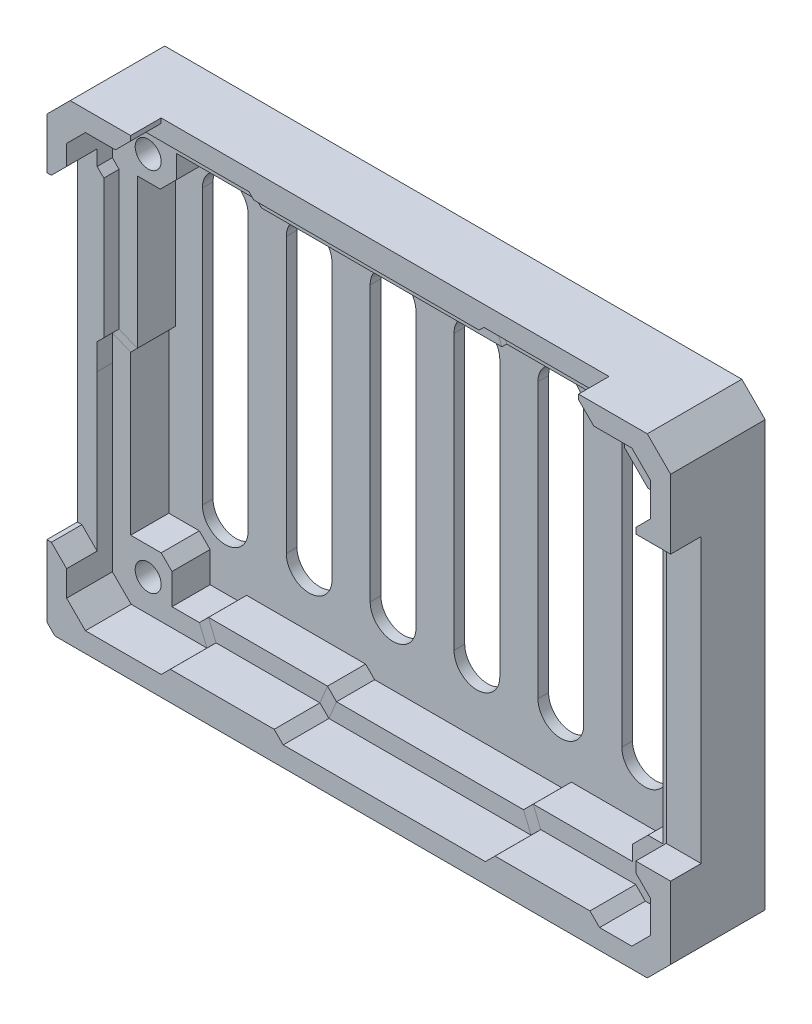
from build123d import *

# Parameters (mm, degrees)
SKETCH_1_W           = 75
SKETCH_1_H           = 55
EXTRUDE_1_DEPTH      = 12
SKETCH_2_R           = 1.7
CUT_EXTRUDE_1_DEPTH  = 12
SKETCH_5_W           = 85
SKETCH_5_H           = 65
SKETCH_5_W_2         = 75
SKETCH_5_H_2         = 55
EXTRUDE_2_DEPTH      = 12
CUT_EXTRUDE_3_DEPTH  = 2
SKETCH_8_W           = 0.8
SKETCH_8_H           = 2
CUT_EXTRUDE_4_DEPTH  = 4
SKETCH_12_W          = 1.6
SKETCH_12_H          = 4
EXTRUDE_3_DEPTH      = 4
SKETCH_16_R          = 1.7
CUT_EXTRUDE_6_DEPTH  = 4
CUT_EXTRUDE_7_DEPTH  = 6
CHAMFER_1_SIZE       = 4
CHAMFER_2_SIZE       = 2
EXTRUDE_4_DEPTH      = 4
CHAMFER_4_SIZE       = 2
CUT_EXTRUDE_12_DEPTH = 3.6
CUT_EXTRUDE_15_DEPTH = 1
CUT_EXTRUDE_16_DEPTH = 101.765867237
SKETCH_28_R          = 3.1
CUT_EXTRUDE_17_DEPTH = 4


with BuildPart() as part:
    # 草图1 → 凸台-拉伸1 (new body)
    with BuildSketch(Plane.XY):
        with Locations((37.5, -27.5)):
            Rectangle(SKETCH_1_W, SKETCH_1_H)
    extrude(amount=EXTRUDE_1_DEPTH)

    # 草图2 → 切除-拉伸1 (cut)
    with BuildSketch(Plane(origin=(0, 0, 0), x_dir=(-1, 0, 0), z_dir=(0, 0, -1))):
        with Locations((-71.166921514, -3.557475235)):
            Circle(SKETCH_2_R)
        with Locations((-71.166921514, -51.58491491)):
            Circle(SKETCH_2_R)
        with Locations((-3.888803658, -51.58491491)):
            Circle(SKETCH_2_R)
        with Locations((-3.888803658, -3.557475235)):
            Circle(SKETCH_2_R)
    extrude(amount=-CUT_EXTRUDE_1_DEPTH, mode=Mode.SUBTRACT)

    # 草图5 → 凸台-拉伸2 (add)
    with BuildSketch(Plane(origin=(0, 0, 0), x_dir=(-1, 0, 0), z_dir=(0, 0, -1))):
        with Locations((-37.5, -27.5)):
            Rectangle(SKETCH_5_W, SKETCH_5_H)
        with Locations((-37.5, -27.5)):
            Rectangle(SKETCH_5_W_2, SKETCH_5_H_2, mode=Mode.SUBTRACT)
    extrude(amount=-EXTRUDE_2_DEPTH)

    # 草图6 → 切除-拉伸3 (cut)
    with BuildSketch(Plane.XY.offset(12)):
        Polygon((0.871324699, -25.665782408), (0, -26.537107106), (0, -53.007434423), (1.992565577, -55), (11.269684867, -55), (12.461559563, -53.813385827), (26.743585303, -53.817105578), (27.926479725, -55), (53.772720173, -55), (55.043505207, -53.734475489), (68.152434681, -53.73819524), (69.414239441, -55), (72.982184232, -55), (74.974749809, -53.007434423), (74.974749809, -49.491704516), (73.028310897, -47.54000508), (73.032030648, -7.646889678), (74.974749809, -5.704170516), (74.974749809, -2.017856408), (72.982184232, -0.025290831), (50.245113202, -0.025290831), (49.61482093, -0.650322581), (19.394872914, -0.646602829), (18.773560915, -0.025290831), (1.992565577, -0.025290831), (0, -2.017856408), (0, -5.982633813), (0.87504445, -6.862938786), align=None)
    extrude(amount=-CUT_EXTRUDE_3_DEPTH, mode=Mode.SUBTRACT)

    # Sweep 1: sweep along a path in 草图7
    with BuildLine(Plane.XY.offset(10)) as sweep_1_path:
        Line((0.87504445, -6.862938786), (0.871324699, -25.665782408))
        Line((0.871324699, -25.665782408), (0, -26.537107106))
        Line((0, -26.537107106), (0, -53.007434423))
        Line((0, -53.007434423), (1.992565577, -55))
        Line((1.992565577, -55), (11.269684867, -55))
        Line((11.269684867, -55), (12.461559563, -53.813385827))
        Line((12.461559563, -53.813385827), (26.743585303, -53.817105578))
        Line((26.743585303, -53.817105578), (27.926479725, -55))
        Line((27.926479725, -55), (53.772720173, -55))
        Line((53.772720173, -55), (55.043505207, -53.734475489))
        Line((55.043505207, -53.734475489), (68.152434681, -53.73819524))
        Line((68.152434681, -53.73819524), (69.414239441, -55))
        Line((69.414239441, -55), (72.982184232, -55))
        Line((72.982184232, -55), (74.974749809, -53.007434423))
        Line((74.974749809, -53.007434423), (74.974749809, -49.491704516))
        Line((74.974749809, -49.491704516), (73.028310897, -47.54000508))
        Line((73.028310897, -47.54000508), (73.032030648, -7.646889678))
        Line((73.032030648, -7.646889678), (74.974749809, -5.704170516))
        Line((74.974749809, -5.704170516), (74.974749809, -2.017856408))
        Line((74.974749809, -2.017856408), (72.982184232, -0.025290831))
        Line((72.982184232, -0.025290831), (50.245113202, -0.025290831))
        Line((50.245113202, -0.025290831), (49.61482093, -0.650322581))
        Line((49.61482093, -0.650322581), (19.394872914, -0.646602829))
        Line((19.394872914, -0.646602829), (18.773560915, -0.025290831))
        Line((18.773560915, -0.025290831), (1.992565577, -0.025290831))
        Line((1.992565577, -0.025290831), (0, -2.017856408))
        Line((0, -2.017856408), (0, -5.982633813))
        Line((0, -5.982633813), (0.87504445, -6.862938786))
    # 草图8 → Sweep 1 (sweep, cut)
    with BuildSketch(Plane(origin=(47.466326748, -29.617285171, 16.834886136), x_dir=(1, 0, 0), z_dir=(0, 1, 0))):
        with Locations((-47.866326748, 5.834886136)):
            Rectangle(SKETCH_8_W, SKETCH_8_H)
    sweep(path=sweep_1_path.line, transition=Transition.RIGHT, mode=Mode.SUBTRACT)

    # 草图9 → 切除-拉伸4 (cut)
    with BuildSketch(Plane.XY.offset(10)):
        Polygon((0.871324699, -25.665782408), (0, -26.537107106), (0, -53.007434423), (1.992565577, -55), (11.269684867, -55), (12.461559563, -53.813385827), (26.743585303, -53.817105578), (27.926479725, -55), (53.772720173, -55), (55.043505207, -53.734475489), (68.152434681, -53.73819524), (69.414239441, -55), (72.982184232, -55), (74.974749809, -53.007434423), (74.974749809, -49.491704516), (73.028310897, -47.54000508), (73.032030648, -7.646889678), (74.974749809, -5.704170516), (74.974749809, -2.017856408), (72.982184232, -0.025290831), (50.245113202, -0.025290831), (49.61482093, -0.650322581), (19.394872914, -0.646602829), (18.773560915, -0.025290831), (1.992565577, -0.025290831), (0, -2.017856408), (0, -5.982633813), (0.87504445, -6.862938786), align=None)
    extrude(amount=-CUT_EXTRUDE_4_DEPTH, mode=Mode.SUBTRACT)

    # Sweep 1 2: sweep along a path in 草图10
    with BuildLine(Plane.XY.offset(6)) as sweep_1_2_path:
        Line((0.87504445, -6.862938786), (0.871324699, -25.665782408))
        Line((0.871324699, -25.665782408), (0, -26.537107106))
        Line((0, -26.537107106), (0, -53.007434423))
        Line((0, -53.007434423), (1.992565577, -55))
        Line((1.992565577, -55), (11.269684867, -55))
        Line((11.269684867, -55), (12.461559563, -53.813385827))
        Line((12.461559563, -53.813385827), (26.743585303, -53.817105578))
        Line((26.743585303, -53.817105578), (27.926479725, -55))
        Line((27.926479725, -55), (53.772720173, -55))
        Line((53.772720173, -55), (55.043505207, -53.734475489))
        Line((55.043505207, -53.734475489), (68.152434681, -53.73819524))
        Line((68.152434681, -53.73819524), (69.414239441, -55))
        Line((69.414239441, -55), (72.982184232, -55))
        Line((72.982184232, -55), (74.974749809, -53.007434423))
        Line((74.974749809, -53.007434423), (74.974749809, -49.491704516))
        Line((74.974749809, -49.491704516), (73.028310897, -47.54000508))
        Line((73.028310897, -47.54000508), (73.032030648, -7.646889678))
        Line((73.032030648, -7.646889678), (74.974749809, -5.704170516))
        Line((74.974749809, -5.704170516), (74.974749809, -2.017856408))
        Line((74.974749809, -2.017856408), (72.982184232, -0.025290831))
        Line((72.982184232, -0.025290831), (50.245113202, -0.025290831))
        Line((50.245113202, -0.025290831), (49.61482093, -0.650322581))
        Line((49.61482093, -0.650322581), (19.394872914, -0.646602829))
        Line((19.394872914, -0.646602829), (18.773560915, -0.025290831))
        Line((18.773560915, -0.025290831), (1.992565577, -0.025290831))
        Line((1.992565577, -0.025290831), (0, -2.017856408))
        Line((0, -2.017856408), (0, -5.982633813))
        Line((0, -5.982633813), (0.87504445, -6.862938786))
    # 草图12 → Sweep 1 2 (sweep)
    with BuildSketch(Plane(origin=(47.466326748, -29.617285171, 16.834886136), x_dir=(1, 0, 0), z_dir=(0, 1, 0))):
        with Locations((24.763844024, 8.834886136)):
            Rectangle(SKETCH_12_W, SKETCH_12_H)
    sweep(path=sweep_1_2_path.line, transition=Transition.RIGHT)

    # 草图15 → 凸台-拉伸3 (add)
    with BuildSketch(Plane.XY.offset(6)):
        Polygon((1.599811284, -47.985975153), (5.599811284, -47.985975153), (7.014024847, -49.400188716), (7.014024847, -53.400188716), (2.655229109, -53.400188716), (1.599811284, -52.344770891), align=None)
        Polygon((71.42844383, -48.138178454), (69.42844383, -48.138178454), (67.42844383, -50.138178454), (67.42844383, -52.138178454), (68.815286237, -52.13857198), (70.076902972, -53.400188716), (72.319520701, -53.400188716), (73.374938525, -52.344770891), (73.374938525, -50.153103724), (71.42843794, -48.201342449), align=None)
        Polygon((7.59619916, -1.625102115), (7.59619916, -4.625102115), (5.474878816, -6.746422459), (2.474878816, -6.746422459), (2.474986279, -6.203213329), (1.599811284, -5.322777027), (1.599811284, -2.680519939), (2.655229109, -1.625102115), align=None)
        Polygon((72.319520701, -1.625102115), (66.319520701, -1.625102115), (66.319520701, -5.625102115), (69.432117646, -8.73769906), (71.432117646, -8.73769906), (71.432281151, -6.984164359), (73.303483781, -5.112961729), (73.374938525, -5.041506985), (73.374938525, -2.680519939), align=None)
    extrude(amount=EXTRUDE_3_DEPTH)

    # 草图16 → 切除-拉伸6 (cut)
    with BuildSketch(Plane(origin=(0, 0, 6), x_dir=(-1, 0, 0), z_dir=(0, 0, -1))):
        with Locations((-3.888803658, -51.58491491)):
            Circle(SKETCH_16_R)
        with Locations((-71.166921514, -51.58491491)):
            Circle(SKETCH_16_R)
        with Locations((-71.166921514, -3.557475235)):
            Circle(SKETCH_16_R)
        with Locations((-3.888803658, -3.557475235)):
            Circle(SKETCH_16_R)
    extrude(amount=-CUT_EXTRUDE_6_DEPTH, mode=Mode.SUBTRACT)

    # 草图17 → 切除-拉伸7 (cut)
    with BuildSketch(Plane.XY.offset(6)):
        with BuildLine():
            Line((12, -8.852281976), (12, -44.852281976))
            ThreePointArc((12, -44.852281976), (9, -47.852281976), (6, -44.852281976))
            Line((6, -44.852281976), (6, -8.852281976))
            ThreePointArc((6, -8.852281976), (9, -5.852281976), (12, -8.852281976))
        make_face()
        with BuildLine():
            Line((23, -8.852281976), (23, -44.852281976))
            ThreePointArc((23, -44.852281976), (20, -47.852281976), (17, -44.852281976))
            Line((17, -44.852281976), (17, -8.852281976))
            ThreePointArc((17, -8.852281976), (20, -5.852281976), (23, -8.852281976))
        make_face()
        with BuildLine():
            Line((34, -8.852281976), (34, -44.852281976))
            ThreePointArc((34, -44.852281976), (31, -47.852281976), (28, -44.852281976))
            Line((28, -44.852281976), (28, -8.852281976))
            ThreePointArc((28, -8.852281976), (31, -5.852281976), (34, -8.852281976))
        make_face()
        with BuildLine():
            Line((45, -8.852281976), (45, -44.852281976))
            ThreePointArc((45, -44.852281976), (42, -47.852281976), (39, -44.852281976))
            Line((39, -44.852281976), (39, -8.852281976))
            ThreePointArc((39, -8.852281976), (42, -5.852281976), (45, -8.852281976))
        make_face()
        with BuildLine():
            Line((56, -8.852281976), (56, -44.852281976))
            ThreePointArc((56, -44.852281976), (53, -47.852281976), (50, -44.852281976))
            Line((50, -44.852281976), (50, -8.852281976))
            ThreePointArc((50, -8.852281976), (53, -5.852281976), (56, -8.852281976))
        make_face()
        with BuildLine():
            Line((67, -8.852281976), (67, -44.852281976))
            ThreePointArc((67, -44.852281976), (64, -47.852281976), (61, -44.852281976))
            Line((61, -44.852281976), (61, -8.852281976))
            ThreePointArc((61, -8.852281976), (64, -5.852281976), (67, -8.852281976))
        make_face()
    extrude(amount=-CUT_EXTRUDE_7_DEPTH, mode=Mode.SUBTRACT)

    # 倒角1
    chamfer_1_edges = [part.edges().sort_by_distance(p)[0] for p in [
        (-5, 5, 6),
        (80, -60, 6),
        (80, 5, 6),
    ]]
    chamfer(chamfer_1_edges, length=CHAMFER_1_SIZE)

    # 倒角2
    chamfer_2_edges = [part.edges().sort_by_distance(p)[0] for p in [
        (-5, -60, 6),
    ]]
    chamfer(chamfer_2_edges, length=CHAMFER_2_SIZE)

    # 草图20 → 凸台-拉伸4 (add)
    with BuildSketch(Plane.XY.offset(12)):
        Polygon((-5, -6.312601125), (-0.8, -6.312601125), (-0.8, -1.686485558), (1.661194727, 0.774709169), (7.59619916, 0.774709169), (7.59619916, 5), (-1, 5), (-5, 1), align=None)
        Polygon((-0.8, -53.338805273), (-0.8, -47.985975153), (-5, -47.985975153), (-5, -58), (-3, -60), (76, -60), (80, -56), (80, -45.869766166), (73.828466638, -45.869766166), (73.828341736, -47.209297389), (75.774749809, -49.160965902), (75.774749809, -53.338805273), (73.313555082, -55.8), (69.580957304, -55.8), (69.082868591, -55.8), (67.820969808, -54.538101217), (55.37381035, -54.534569248), (54.103119465, -55.8), (27.595108875, -55.8), (26.412128153, -54.617019277), (12.791807996, -54.613471867), (11.600019722, -55.8), (1.661194727, -55.8), align=None)
        Polygon((76, 5), (66.319520701, 5), (66.319520701, 0.774709169), (73.313555082, 0.774709169), (75.774749809, -1.686485558), (75.774749809, -6.035541366), (73.831999751, -7.978291425), (73.831928941, -8.73769906), (80, -8.73769906), (80, 1), align=None)
    extrude(amount=EXTRUDE_4_DEPTH)

    # 倒角4
    chamfer_4_edges = [part.edges().sort_by_distance(p)[0] for p in [
        (7.59619916, 0.774709169, 14),
        (-0.8, -6.312601125, 14),
        (66.319520701, 0.774709169, 14),
        (-0.8, -47.985975153, 14),
    ]]
    chamfer(chamfer_4_edges, length=CHAMFER_4_SIZE)

    # 草图24 → 切除-拉伸12 (cut)
    with BuildSketch(Plane(origin=(0, 0, 0), x_dir=(-1, 0, 0), z_dir=(0, 0, -1))):
        Polygon((-76, -60), (3, -60), (5, -58), (5, 1), (1, 5), (-76, 5), (-80, 1), (-80, -56), align=None)
    extrude(amount=-CUT_EXTRUDE_12_DEPTH, mode=Mode.SUBTRACT)

    # 草图26 → 切除-拉伸15 (cut)
    with BuildSketch(Plane.XY.offset(6)):
        Polygon((67.42844383, -50.138178454), (69.42844383, -48.138178454), (71.42844383, -48.138178454), (71.430170772, -29.617285171), (71.432117646, -8.73769906), (69.432117646, -8.73769906), (66.319520701, -5.625102115), (66.319520701, -1.625102115), (50.903852973, -1.625102115), (50.273478932, -2.250214951), (18.732127818, -2.246332549), (18.110897384, -1.625102115), (7.59619916, -1.625102115), (7.59619916, -4.625102115), (5.474878816, -6.746422459), (2.474878816, -6.746422459), (2.471004894, -26.328577028), (1.599811284, -27.199770638), (1.599811284, -47.985975153), (5.599811284, -47.985975153), (7.014024847, -49.400188716), (7.014024847, -53.400188716), (10.609093081, -53.400188716), (11.801140601, -52.213402482), (27.406421416, -52.217466875), (28.589143256, -53.400188716), (53.11199953, -53.400188716), (54.382972838, -52.134476709), (67.42844383, -52.138178454), align=None)
        with BuildLine():
            Line((67, -44.852281976), (67, -8.852281976))
            ThreePointArc((67, -8.852281976), (64, -5.852281976), (61, -8.852281976))
            Line((61, -8.852281976), (61, -44.852281976))
            ThreePointArc((61, -44.852281976), (64, -47.852281976), (67, -44.852281976))
        make_face(mode=Mode.SUBTRACT)
        with BuildLine():
            Line((56, -44.852281976), (56, -8.852281976))
            ThreePointArc((56, -8.852281976), (53, -5.852281976), (50, -8.852281976))
            Line((50, -8.852281976), (50, -44.852281976))
            ThreePointArc((50, -44.852281976), (53, -47.852281976), (56, -44.852281976))
        make_face(mode=Mode.SUBTRACT)
        with BuildLine():
            Line((34, -44.852281976), (34, -8.852281976))
            ThreePointArc((34, -8.852281976), (31, -5.852281976), (28, -8.852281976))
            Line((28, -8.852281976), (28, -44.852281976))
            ThreePointArc((28, -44.852281976), (31, -47.852281976), (34, -44.852281976))
        make_face(mode=Mode.SUBTRACT)
        with BuildLine():
            Line((23, -44.852281976), (23, -8.852281976))
            ThreePointArc((23, -8.852281976), (20, -5.852281976), (17, -8.852281976))
            Line((17, -8.852281976), (17, -44.852281976))
            ThreePointArc((17, -44.852281976), (20, -47.852281976), (23, -44.852281976))
        make_face(mode=Mode.SUBTRACT)
        with BuildLine():
            Line((12, -44.852281976), (12, -8.852281976))
            ThreePointArc((12, -8.852281976), (9, -5.852281976), (6, -8.852281976))
            Line((6, -8.852281976), (6, -44.852281976))
            ThreePointArc((6, -44.852281976), (9, -47.852281976), (12, -44.852281976))
        make_face(mode=Mode.SUBTRACT)
        with BuildLine():
            Line((45, -44.852281976), (45, -8.852281976))
            ThreePointArc((45, -8.852281976), (42, -5.852281976), (39, -8.852281976))
            Line((39, -8.852281976), (39, -44.852281976))
            ThreePointArc((39, -44.852281976), (42, -47.852281976), (45, -44.852281976))
        make_face(mode=Mode.SUBTRACT)
    extrude(amount=-CUT_EXTRUDE_15_DEPTH, mode=Mode.SUBTRACT)

    # 草图27 → 切除-拉伸16 (cut, through all)
    with BuildSketch(Plane(origin=(0, 0, 3.6), x_dir=(-1, 0, 0), z_dir=(0, 0, -1))):
        Polygon((-80, 1), (-80, -56), (-76, -60), (3, -60), (5, -58), (5, 1), (1, 5), (-76, 5), align=None)
        Polygon((-78.4, 0.3372583), (-78.4, -55.3372583), (-75.3372583, -58.4), (2.3372583, -58.4), (3.4, -57.3372583), (3.4, 0.3372583), (0.3372583, 3.4), (-75.3372583, 3.4), align=None, mode=Mode.SUBTRACT)
    extrude(amount=-CUT_EXTRUDE_16_DEPTH, mode=Mode.SUBTRACT)

    # 草图28 → 切除-拉伸17 (cut)
    with BuildSketch(Plane(origin=(0, 0, 3.6), x_dir=(-1, 0, 0), z_dir=(0, 0, -1))):
        with Locations((-71.166921514, -3.557475235)):
            Circle(SKETCH_28_R)
        with Locations((-3.888803658, -3.557475235)):
            Circle(SKETCH_28_R)
        with Locations((-3.888803658, -51.58491491)):
            Circle(SKETCH_28_R)
        with Locations((-71.166921514, -51.58491491)):
            Circle(SKETCH_28_R)
    extrude(amount=-CUT_EXTRUDE_17_DEPTH, mode=Mode.SUBTRACT)


solid = part.part
